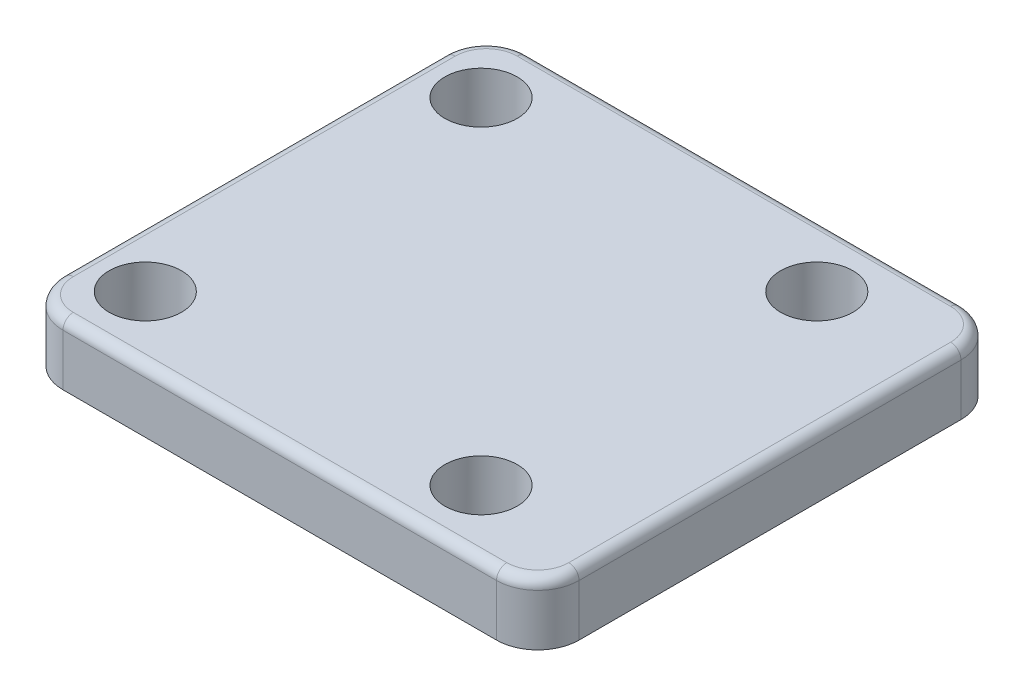
from build123d import *

# Parameters (mm, degrees)
BOSS_EXTRUDE1_DEPTH = 6
FILLET1_R           = 1
SKETCH2_R           = 16
BOSS_EXTRUDE2_DEPTH = 2
SKETCH3_R           = 3.5
CUT_EXTRUDE1_DEPTH  = 37.800135869
CHAMFER1_SIZE       = 1
CHAMFER1_SIZE2      = 1.732050808


with BuildPart() as part:
    # Sketch1 → Boss-Extrude1 (new body)
    with BuildSketch(Plane(origin=(0, 0, 0), x_dir=(1, 0, 0), z_dir=(0, 1, 0))):
        with BuildLine():
            Line((-18, 22.5), (24, 22.5))
            ThreePointArc((24, 22.5), (26.828427125, 21.328427125), (28, 18.5))
            Line((28, 18.5), (28, -18.5))
            ThreePointArc((28, -18.5), (26.828427125, -21.328427125), (24, -22.5))
            Line((24, -22.5), (-18, -22.5))
            ThreePointArc((-18, -22.5), (-20.828427125, -21.328427125), (-22, -18.5))
            Line((-22, -18.5), (-22, 18.5))
            ThreePointArc((-22, 18.5), (-20.828427125, 21.328427125), (-18, 22.5))
        make_face()
    extrude(amount=BOSS_EXTRUDE1_DEPTH)

    # Fillet1
    fillet1_edges = [part.edges().sort_by_distance(p)[0] for p in [
        (-20.828427125, 6, -21.328427125),
        (-22, 6, 0),
        (-20.828427125, 6, 21.328427125),
        (3, 6, 22.5),
        (26.828427125, 6, 21.328427125),
        (28, 6, 0),
        (26.828427125, 6, -21.328427125),
        (3, 6, -22.5),
    ]]
    fillet(fillet1_edges, radius=FILLET1_R)

    # Sketch2 → Boss-Extrude2 (add)
    with BuildSketch(Plane.XZ):
        with Locations(Location((0, 0, 0), (0, 0, 270))):
            Circle(SKETCH2_R)
    extrude(amount=BOSS_EXTRUDE2_DEPTH)

    # Sketch3 → Cut-Extrude1 (cut, through all)
    with BuildSketch(Plane(origin=(0, 6, 0), x_dir=(1, 0, 0), z_dir=(0, 1, 0))):
        with Locations(Location((-16.263455967, 16.263455967, 0), (0, 0, 270))):
            Circle(SKETCH3_R)
        with Locations(Location((16.263455967, 16.263455967, 0), (0, 0, 270))):
            Circle(SKETCH3_R)
        with Locations(Location((16.263455967, -16.263455967, 0), (0, 0, 270))):
            Circle(SKETCH3_R)
        with Locations(Location((-16.263455967, -16.263455967, 0), (0, 0, 270))):
            Circle(SKETCH3_R)
    extrude(amount=-CUT_EXTRUDE1_DEPTH, mode=Mode.SUBTRACT)

    # Chamfer1
    chamfer1_edges = [part.edges().sort_by_distance(p)[0] for p in [
        (0, -2, 16),
    ]]
    chamfer1_side = [part.faces().sort_by_distance(p)[0] for p in [
        (0, -1, 16),
    ]]
    chamfer(chamfer1_edges, length=CHAMFER1_SIZE, length2=CHAMFER1_SIZE2, reference=chamfer1_side[0])


solid = part.part
